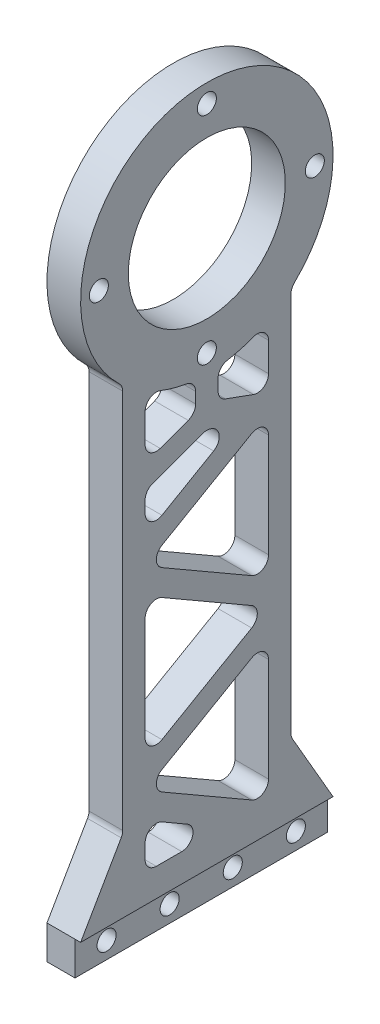
from build123d import *

# Parameters (mm, degrees)
SKETCH_1_W          = 6
SKETCH_1_H          = 30
EXTRUDE_1_DEPTH     = 227
SKETCH_2_R          = 22.5
EXTRUDE_2_DEPTH     = 6
SKETCH_3_R          = 14
CUT_EXTRUDE_1_DEPTH = 231.154839184
HOLE_WIZARD_M32_D   = 3.4
EXTRUDE_3_DEPTH     = 6
HOLE_WIZARD_M31_D   = 3.4
SKETCH_14_W         = 45
SKETCH_14_H         = 6
CUT_EXTRUDE_2_DEPTH = 1
CUT_EXTRUDE_START   = -6
CUT_EXTRUDE_3_DEPTH = 6
CUT_EXTRUDE_5_REACH = 135.036
FILLET_2_R          = 2


with BuildPart() as part:
    # Эскиз1 → Бобышка-Вытянуть1 (new body)
    with BuildSketch(Plane(origin=(0, 0, 0), x_dir=(1, 0, 0), z_dir=(0, 1, 0))):
        with Locations((3, -15)):
            Rectangle(SKETCH_1_W, SKETCH_1_H)
    extrude(amount=EXTRUDE_1_DEPTH)

    # Эскиз2 → Бобышка-Вытянуть2 (add)
    with BuildSketch(Plane.ZY):
        with Locations((15, 105)):
            Circle(SKETCH_2_R)
    extrude(amount=-EXTRUDE_2_DEPTH)

    # Эскиз3 → Вырез-Вытянуть1 (cut, through all)
    with BuildSketch(Plane.ZY):
        with Locations((15, 105)):
            Circle(SKETCH_3_R)
    extrude(amount=-CUT_EXTRUDE_1_DEPTH, mode=Mode.SUBTRACT)

    # Отверстие с зазором M32 (through all)
    with Locations(Plane(origin=(6, -25.024735225, 7.262908886), x_dir=(0, 0, 1), z_dir=(1, 0, 0))):
        with Locations((7.737091114, -149.274735225), (-11.512908886, -130.024735225), (7.737091114, -110.774735225), (26.987091114, -130.024735225)):
            Hole(HOLE_WIZARD_M32_D / 2)

    # Эскиз11 → Бобышка-Вытянуть3 (add)
    with BuildSketch(Plane(origin=(6, 0, 0), x_dir=(0, 0, -1), z_dir=(1, 0, 0))):
        Polygon((0, 18.990381057), (7.5, 6), (7.5, 0), (-37.5, 0), (-37.5, 6), (-30, 18.990381057), align=None)
    extrude(amount=-EXTRUDE_3_DEPTH)

    # Отверстие с зазором M31 (through all)
    with Locations(Plane(origin=(6, 0, 0), x_dir=(0, 0, -1), z_dir=(1, 0, 0))):
        with Locations((-31.875, 3), (-20.625, 3), (-9.375, 3), (1.875, 3)):
            Hole(HOLE_WIZARD_M31_D / 2)

    # Эскиз14 → Вырез-Вытянуть2 (cut)
    with BuildSketch(Plane(origin=(6, 0, 0), x_dir=(0, 0, -1), z_dir=(1, 0, 0))):
        with Locations((-15, 3)):
            Rectangle(SKETCH_14_W, SKETCH_14_H)
    extrude(amount=-CUT_EXTRUDE_2_DEPTH, mode=Mode.SUBTRACT)

    # Эскиз15 → Вырез-Вытянуть3 (cut)
    with BuildSketch(Plane(origin=(6, 0, 0), x_dir=(0, 0, -1), z_dir=(1, 0, 0)).offset(CUT_EXTRUDE_START)):
        with BuildLine():
            Line((-30, 227), (0, 227))
            Line((0, 227), (0, 121.770509831))
            ThreePointArc((0, 121.770509831), (-15, 127.5), (-30, 121.770509831))
            Line((-30, 121.770509831), (-30, 227))
        make_face()
    extrude(amount=CUT_EXTRUDE_3_DEPTH, mode=Mode.SUBTRACT)

    # Эскиз17 → Вырез-Вытянуть5 (cut, up to next)
    with BuildSketch(Plane(origin=(6, 0, 0), x_dir=(0, 0, -1), z_dir=(1, 0, 0)), mode=Mode.PRIVATE) as cut_extrude_5_sk1:
        with BuildLine():
            Line((-17, 82.589065169), (-17, 77.479065169))
            Line((-17, 77.479065169), (-26, 74.203333061))
            Line((-26, 74.203333061), (-26, 85.372213574))
            ThreePointArc((-26, 85.372213574), (-21.647291084, 83.504337153), (-17, 82.589065169))
        make_face()
    cut_extrude_5_tool1 = extrude(cut_extrude_5_sk1.sketch, amount=-CUT_EXTRUDE_5_REACH, mode=Mode.PRIVATE) & part.part
    # Эскиз17 → Вырез-Вытянуть5 (cut, up to next)
    with BuildSketch(Plane(origin=(6, 0, 0), x_dir=(0, 0, -1), z_dir=(1, 0, 0)), mode=Mode.PRIVATE) as cut_extrude_5_sk2:
        with BuildLine():
            Line((-13, 82.589065169), (-13, 77.479065169))
            Line((-13, 77.479065169), (-4, 74.203333061))
            Line((-4, 74.203333061), (-4, 85.372213574))
            ThreePointArc((-4, 85.372213574), (-8.352708916, 83.504337153), (-13, 82.589065169))
        make_face()
    cut_extrude_5_tool2 = extrude(cut_extrude_5_sk2.sketch, amount=-CUT_EXTRUDE_5_REACH, mode=Mode.PRIVATE) & part.part
    # Эскиз17 → Вырез-Вытянуть5 (cut, up to next)
    with BuildSketch(Plane(origin=(6, 0, 0), x_dir=(0, 0, -1), z_dir=(1, 0, 0)), mode=Mode.PRIVATE) as cut_extrude_5_sk3:
        Polygon((-26, 69.946621971), (-15, 73.950294548), (-10.072966814, 72.157001125), (-26, 62.961524227), align=None)
    cut_extrude_5_tool3 = extrude(cut_extrude_5_sk3.sketch, amount=-CUT_EXTRUDE_5_REACH, mode=Mode.PRIVATE) & part.part
    # Эскиз17 → Вырез-Вытянуть5 (cut, up to next)
    with BuildSketch(Plane(origin=(6, 0, 0), x_dir=(0, 0, -1), z_dir=(1, 0, 0)), mode=Mode.PRIVATE) as cut_extrude_5_sk4:
        Polygon((-4, 71.044427996), (-4, 45.641016151), (-26, 58.342722074), align=None)
    cut_extrude_5_tool4 = extrude(cut_extrude_5_sk4.sketch, amount=-CUT_EXTRUDE_5_REACH, mode=Mode.PRIVATE) & part.part
    # Эскиз17 → Вырез-Вытянуть5 (cut, up to next)
    with BuildSketch(Plane(origin=(6, 0, 0), x_dir=(0, 0, -1), z_dir=(1, 0, 0)), mode=Mode.PRIVATE) as cut_extrude_5_sk5:
        Polygon((-26, 53.72391992), (-4, 41.022213998), (-26, 28.320508076), align=None)
    cut_extrude_5_tool5 = extrude(cut_extrude_5_sk5.sketch, amount=-CUT_EXTRUDE_5_REACH, mode=Mode.PRIVATE) & part.part
    # Эскиз17 → Вырез-Вытянуть5 (cut, up to next)
    with BuildSketch(Plane(origin=(6, 0, 0), x_dir=(0, 0, -1), z_dir=(1, 0, 0)), mode=Mode.PRIVATE) as cut_extrude_5_sk6:
        Polygon((-26, 23.701705922), (-4, 36.403411844), (-4, 11), align=None)
    cut_extrude_5_tool6 = extrude(cut_extrude_5_sk6.sketch, amount=-CUT_EXTRUDE_5_REACH, mode=Mode.PRIVATE) & part.part
    # Эскиз17 → Вырез-Вытянуть5 (cut, up to next)
    with BuildSketch(Plane(origin=(6, 0, 0), x_dir=(0, 0, -1), z_dir=(1, 0, 0)), mode=Mode.PRIVATE) as cut_extrude_5_sk7:
        Polygon((-26, 19.082903769), (-12, 11), (-26, 11), align=None)
    cut_extrude_5_tool7 = extrude(cut_extrude_5_sk7.sketch, amount=-CUT_EXTRUDE_5_REACH, mode=Mode.PRIVATE) & part.part
    add(cut_extrude_5_tool1.solids().sort_by_distance((6, 79.721351, 22.080636))[0], mode=Mode.SUBTRACT)
    add(cut_extrude_5_tool2.solids().sort_by_distance((6, 79.721351, 7.919364))[0], mode=Mode.SUBTRACT)
    add(cut_extrude_5_tool3.solids().sort_by_distance((6, 69.313955, 19.731103))[0], mode=Mode.SUBTRACT)
    add(cut_extrude_5_tool4.solids().sort_by_distance((6, 58.342722, 11.333333))[0], mode=Mode.SUBTRACT)
    add(cut_extrude_5_tool5.solids().sort_by_distance((6, 41.022214, 18.666667))[0], mode=Mode.SUBTRACT)
    add(cut_extrude_5_tool6.solids().sort_by_distance((6, 23.701706, 11.333333))[0], mode=Mode.SUBTRACT)
    add(cut_extrude_5_tool7.solids().sort_by_distance((6, 13.694301, 21.333333))[0], mode=Mode.SUBTRACT)

    # Скругление2
    fillet_2_edges = [part.edges().sort_by_distance(p)[0] for p in [
        (3, 88.229490169, 0),
        (3, 85.372213574, 26),
        (3, 82.589065169, 17),
        (3, 77.479065169, 17),
        (3, 74.203333061, 26),
        (3, 82.589065169, 13),
        (3, 85.372213574, 4),
        (3, 74.203333061, 4),
        (3, 77.479065169, 13),
        (3, 62.961524227, 26),
        (3, 69.946621971, 26),
        (3, 73.950294548, 15),
        (3, 72.157001125, 10.072966814),
        (3, 28.320508076, 26),
        (3, 53.72391992, 26),
        (3, 41.022213998, 4),
        (3, 58.342722074, 26),
        (3, 71.044427996, 4),
        (3, 45.641016151, 4),
        (3, 88.229490169, 30),
        (3, 11, 4),
        (3, 23.701705922, 26),
        (3, 36.403411844, 4),
        (3, 11, 26),
        (3, 19.082903769, 26),
        (3, 11, 12),
        (3, 18.990381057, 30),
        (3, 18.990381057, 0),
    ]]
    fillet(fillet_2_edges, radius=FILLET_2_R)


solid = part.part
